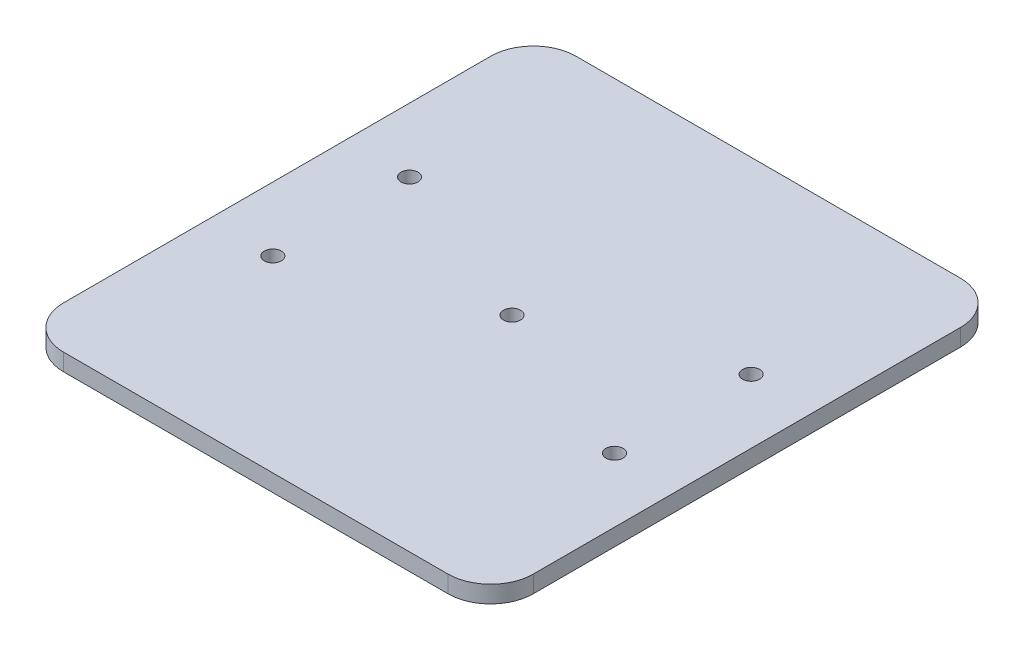
from build123d import *

# Parameters (mm, degrees)
SKETCH1_R           = 1
BOSS_EXTRUDE1_DEPTH = 2
SKETCH2_R           = 1
CUT_EXTRUDE1_DEPTH  = 9


with BuildPart() as part:
    # Sketch1 → Boss-Extrude1 (new body)
    with BuildSketch(Plane(origin=(0, 0, 0), x_dir=(1, 0, 0), z_dir=(0, 1, 0))):
        with BuildLine():
            Line((-36.800947867, 29.857819905), (8.199052133, 29.857819905))
            ThreePointArc((8.199052133, 29.857819905), (11.734586039, 28.393353811), (13.199052133, 24.857819905))
            Line((13.199052133, 24.857819905), (13.199052133, -25.142180095))
            ThreePointArc((13.199052133, -25.142180095), (11.734586039, -28.677714001), (8.199052133, -30.142180095))
            Line((8.199052133, -30.142180095), (-36.800947867, -30.142180095))
            ThreePointArc((-36.800947867, -30.142180095), (-40.336481773, -28.677714001), (-41.800947867, -25.142180095))
            Line((-41.800947867, -25.142180095), (-41.800947867, 24.857819905))
            ThreePointArc((-41.800947867, 24.857819905), (-40.336481773, 28.393353811), (-36.800947867, 29.857819905))
        make_face()
        with Locations(Location((-34.300947867, 7.857819905, 0), (0, 0, 270))):
            Circle(SKETCH1_R, mode=Mode.SUBTRACT)
        with Locations(Location((-34.300947867, -8.142180095, 0), (0, 0, 270))):
            Circle(SKETCH1_R, mode=Mode.SUBTRACT)
        with Locations(Location((-14.300947867, -0.142180095, 0), (0, 0, 270))):
            Circle(SKETCH1_R, mode=Mode.SUBTRACT)
    extrude(amount=BOSS_EXTRUDE1_DEPTH)

    # Sketch2 → Cut-Extrude1 (cut)
    with BuildSketch(Plane(origin=(0, 0, 0), x_dir=(1, 0, 0), z_dir=(0, 1, 0))):
        with Locations(Location((5.699052133, 7.857819905, 0), (0, 0, 270))):
            Circle(SKETCH2_R)
        with Locations(Location((5.699052133, -8.142180095, 0), (0, 0, 270))):
            Circle(SKETCH2_R)
    extrude(amount=CUT_EXTRUDE1_DEPTH, mode=Mode.SUBTRACT)


solid = part.part
